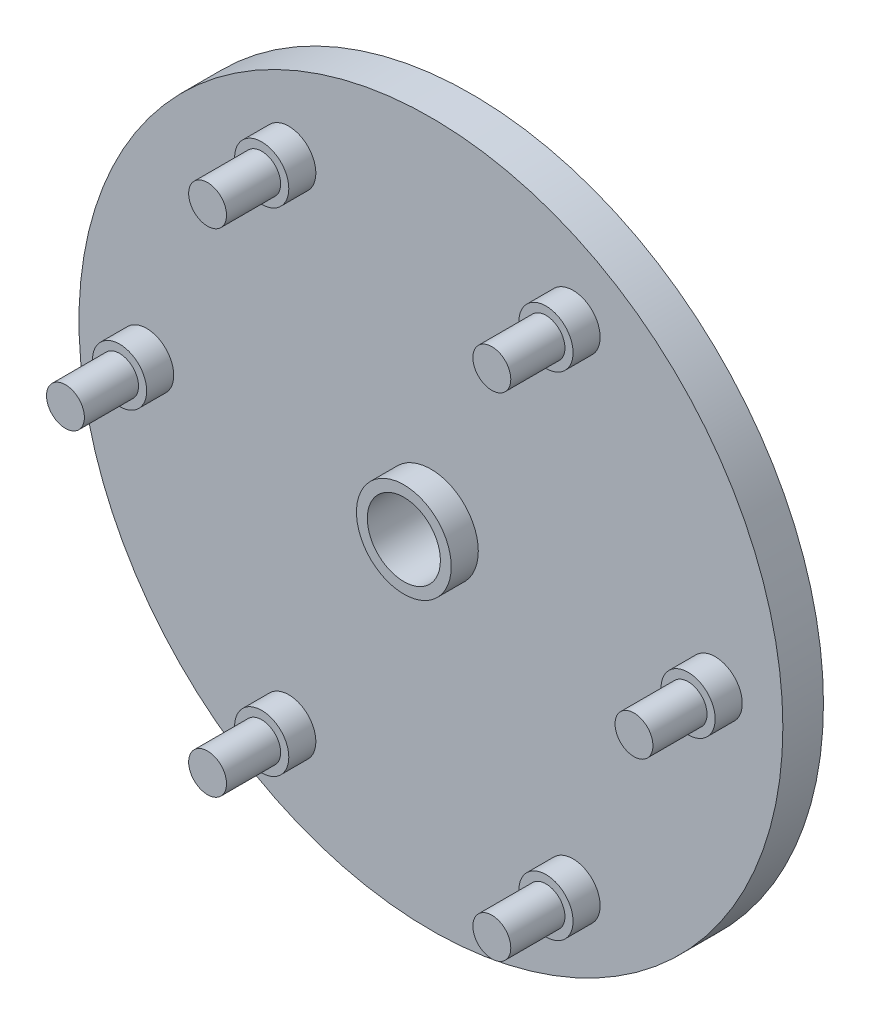
from build123d import *

# Parameters (mm, degrees)
SKETCH_1_R          = 26
EXTRUDE_1_DEPTH     = 3
SKETCH_2_R          = 1.4
EXTRUDE_2_DEPTH     = 6
SKETCH_4_R          = 2
EXTRUDE_4_DEPTH     = 2
SKETCH_5_R          = 6
CUT_EXTRUDE_1_DEPTH = 38.25587202
SKETCH_7_R          = 6
SKETCH_7_R_2        = 2.7
EXTRUDE_1_2_DEPTH   = 8
EXTRUDE_START       = 2
SKETCH_8_R          = 3.5
SKETCH_8_R_2        = 2.7
EXTRUDE_2_2_DEPTH   = 2


with BuildPart() as part:
    # 草图1 → Extrude 1 (new body)
    with BuildSketch(Plane.XY):
        Circle(SKETCH_1_R)
    extrude(amount=-EXTRUDE_1_DEPTH)

    # 草图2 → Extrude 2 (add)
    with BuildSketch(Plane.XY):
        with Locations((-21, 0)):
            Circle(SKETCH_2_R)
        with Locations((-10.5, 18.186533479)):
            Circle(SKETCH_2_R)
        with Locations((10.5, 18.186533479)):
            Circle(SKETCH_2_R)
        with Locations((21, 0)):
            Circle(SKETCH_2_R)
        with Locations((10.5, -18.186533479)):
            Circle(SKETCH_2_R)
        with Locations((-10.5, -18.186533479)):
            Circle(SKETCH_2_R)
    extrude(amount=EXTRUDE_2_DEPTH)

    # 草图4 → 凸台-拉伸4 (add)
    with BuildSketch(Plane.XY):
        with Locations((-10.5, 18.186533479)):
            Circle(SKETCH_4_R)
        with Locations((10.5, 18.186533479)):
            Circle(SKETCH_4_R)
        with Locations((21, 0)):
            Circle(SKETCH_4_R)
        with Locations((10.5, -18.186533479)):
            Circle(SKETCH_4_R)
        with Locations((-10.5, -18.186533479)):
            Circle(SKETCH_4_R)
        with Locations((-21, 0)):
            Circle(SKETCH_4_R)
    extrude(amount=EXTRUDE_4_DEPTH)

    # 草图5 → 切除-拉伸1 (cut, through all)
    with BuildSketch(Plane.XY):
        Circle(SKETCH_5_R)
    extrude(amount=-CUT_EXTRUDE_1_DEPTH, mode=Mode.SUBTRACT)

    # 草图7 → Extrude 1 2 (add)
    with BuildSketch(Plane.XY):
        Circle(SKETCH_7_R)
        Circle(SKETCH_7_R_2, mode=Mode.SUBTRACT)
    extrude(amount=-EXTRUDE_1_2_DEPTH)

    # 草图8 → Extrude 2 2 (add)
    with BuildSketch(Plane.XY.offset(EXTRUDE_START)):
        Circle(SKETCH_8_R)
        Circle(SKETCH_8_R_2, mode=Mode.SUBTRACT)
    extrude(amount=-EXTRUDE_2_2_DEPTH)


solid = part.part
